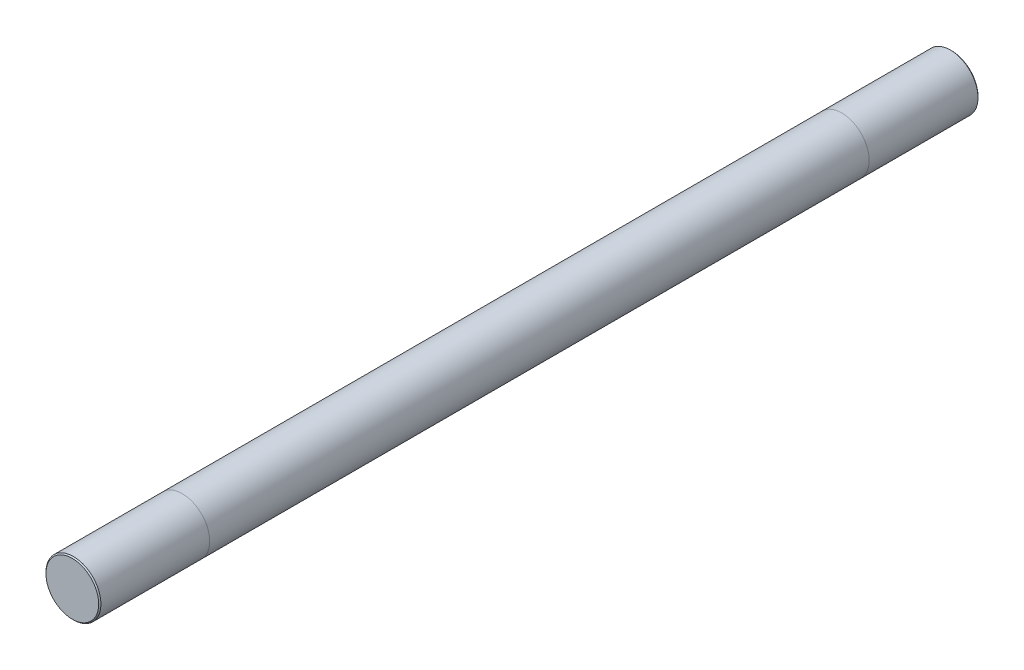
from build123d import *

# Parameters (mm, degrees)
BOSS_EXTRUDE1_DEPTH      = 50.8
BOSS_EXTRUDE1_DEPTH_BACK = 50.8
SKETCH3_R                = 3.175
CHAMFER1_SIZE            = 0.127


with BuildPart() as part:
    # Sketch3 → Boss-Extrude1 (new, two sides: drawn at the far end of the back side and taken through both)
    with BuildSketch(Plane.XY.offset(-BOSS_EXTRUDE1_DEPTH_BACK)):
        Circle(SKETCH3_R)
    extrude(amount=BOSS_EXTRUDE1_DEPTH + BOSS_EXTRUDE1_DEPTH_BACK)

    # Chamfer1
    chamfer1_edges = [part.edges().sort_by_distance(p)[0] for p in [
        (-3.175, 0, -50.8),
        (-3.175, 0, 50.8),
    ]]
    chamfer(chamfer1_edges, length=CHAMFER1_SIZE)


solid = part.part
